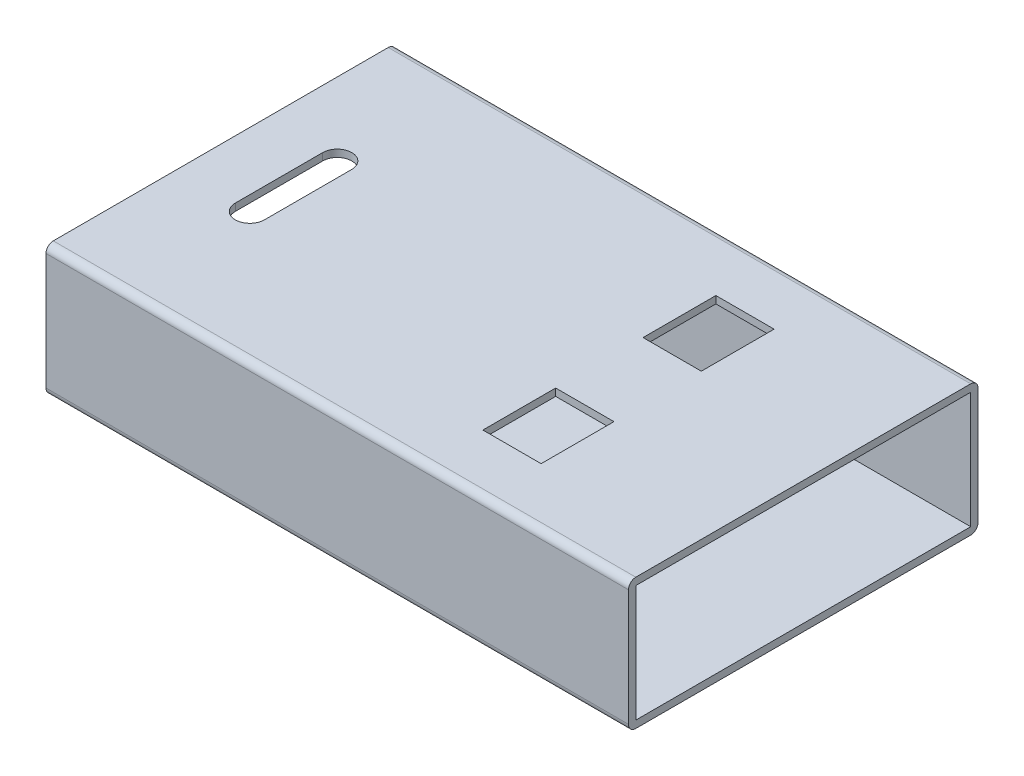
from build123d import *

# Parameters (mm, degrees)
MAIN_SHELL_SKETCH_W     = 11.5
MAIN_SHELL_SKETCH_H     = 4
MAIN_SHELL_DEPTH        = 20
CONNECTOR_HOLE_SKETCH_W = 2
CONNECTOR_HOLE_SKETCH_H = 2.5
CONNECTOR_HOLES_DEPTH   = 22.360009363


with BuildPart() as part:
    # Main_shell_sketch → Main_shell (new body)
    with BuildSketch(Plane(origin=(0, 0, 0), x_dir=(0, 0, -1), z_dir=(1, 0, 0))):
        with BuildLine():
            Line((-6, 2), (-6, -2))
            ThreePointArc((-6, -2), (-5.926776695, -2.176776695), (-5.75, -2.25))
            Line((-5.75, -2.25), (5.75, -2.25))
            ThreePointArc((5.75, -2.25), (5.926776695, -2.176776695), (6, -2))
            Line((6, -2), (6, 2))
            ThreePointArc((6, 2), (5.926776695, 2.176776695), (5.75, 2.25))
            Line((5.75, 2.25), (-5.75, 2.25))
            ThreePointArc((-5.75, 2.25), (-5.926776695, 2.176776695), (-6, 2))
        make_face()
        Rectangle(MAIN_SHELL_SKETCH_W, MAIN_SHELL_SKETCH_H, mode=Mode.SUBTRACT)
    extrude(amount=-MAIN_SHELL_DEPTH)

    # Connector_hole_sketch → Connector_holes (cut, through all)
    with BuildSketch(Plane(origin=(0, 2.25, 0), x_dir=(1, 0, 0), z_dir=(0, 1, 0))):
        with Locations((-6, 2.75)):
            Rectangle(CONNECTOR_HOLE_SKETCH_W, CONNECTOR_HOLE_SKETCH_H)
        with Locations((-6, -2.75)):
            Rectangle(CONNECTOR_HOLE_SKETCH_W, CONNECTOR_HOLE_SKETCH_H)
        with BuildLine():
            Line((-18, -1.5), (-18, 1.5))
            ThreePointArc((-18, 1.5), (-17.5, 2), (-17, 1.5))
            Line((-17, 1.5), (-17, -1.5))
            ThreePointArc((-17, -1.5), (-17.5, -2), (-18, -1.5))
        make_face()
    extrude(amount=-CONNECTOR_HOLES_DEPTH, mode=Mode.SUBTRACT)


solid = part.part
